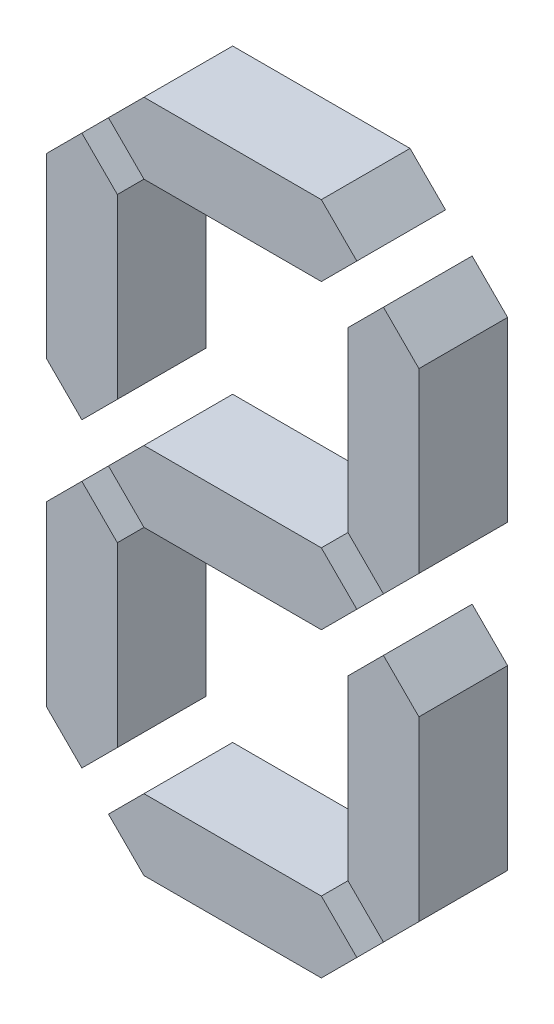
from build123d import *

# Parameters (mm, degrees)
BOSS_EXTRUDE1_DEPTH   = 1
BOSS_EXTRUDE1_2_DEPTH = 1
BOSS_EXTRUDE1_3_DEPTH = 1
BOSS_EXTRUDE1_4_DEPTH = 1
BOSS_EXTRUDE1_5_DEPTH = 1
BOSS_EXTRUDE1_6_DEPTH = 1
BOSS_EXTRUDE1_7_DEPTH = 1


with BuildPart() as part:
    # Sketch1 → Boss-Extrude1 (new body)
    with BuildSketch(Plane.XY):
        Polygon((-2.1, 2.7), (-1.7, 3.1), (-1.3, 2.7), (-1.3, 0.7), (-1.7, 0.3), (-2.1, 0.7), align=None)
    extrude(amount=BOSS_EXTRUDE1_DEPTH)


with BuildPart() as body_2:
    # Sketch1 → Boss-Extrude1 2 (new body)
    with BuildSketch(Plane.XY):
        Polygon((-1, 0.4), (1, 0.4), (1.4, 0), (1, -0.4), (-1, -0.4), (-1.4, 0), align=None)
    extrude(amount=BOSS_EXTRUDE1_2_DEPTH)


with BuildPart() as body_3:
    # Sketch1 → Boss-Extrude1 3 (new body)
    with BuildSketch(Plane.XY):
        Polygon((1.7, -0.3), (2.1, -0.7), (2.1, -2.7), (1.7, -3.1), (1.3, -2.7), (1.3, -0.7), align=None)
    extrude(amount=BOSS_EXTRUDE1_3_DEPTH)


with BuildPart() as body_4:
    # Sketch1 → Boss-Extrude1 4 (new body)
    with BuildSketch(Plane.XY):
        Polygon((-2.1, -2.7), (-1.7, -3.1), (-1.3, -2.7), (-1.3, -0.7), (-1.7, -0.3), (-2.1, -0.7), align=None)
    extrude(amount=BOSS_EXTRUDE1_4_DEPTH)


with BuildPart() as body_5:
    # Sketch1 → Boss-Extrude1 5 (new body)
    with BuildSketch(Plane.XY):
        Polygon((1, -3), (-1, -3), (-1.4, -3.4), (-1, -3.8), (1, -3.8), (1.4, -3.4), align=None)
    extrude(amount=BOSS_EXTRUDE1_5_DEPTH)


with BuildPart() as body_6:
    # Sketch1 → Boss-Extrude1 6 (new body)
    with BuildSketch(Plane.XY):
        Polygon((1.3, 0.7), (1.3, 2.7), (1.7, 3.1), (2.1, 2.7), (2.1, 0.7), (1.7, 0.3), align=None)
    extrude(amount=BOSS_EXTRUDE1_6_DEPTH)


with BuildPart() as body_7:
    # Sketch1 → Boss-Extrude1 7 (new body)
    with BuildSketch(Plane.XY):
        Polygon((1, 3), (-1, 3), (-1.4, 3.4), (-1, 3.8), (1, 3.8), (1.4, 3.4), align=None)
    extrude(amount=BOSS_EXTRUDE1_7_DEPTH)


solid = Compound([part.part, body_2.part, body_3.part, body_4.part, body_5.part, body_6.part, body_7.part])
